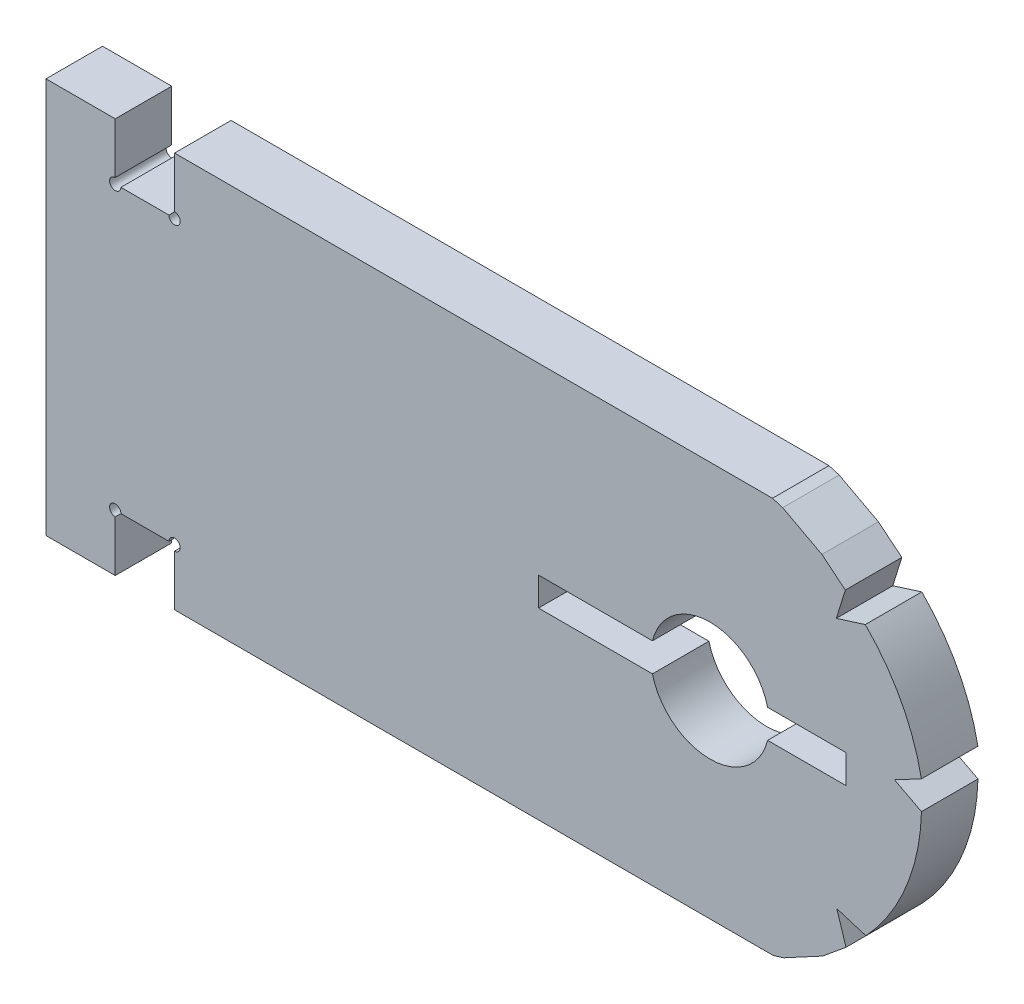
from build123d import *

# Parameters (mm, degrees)
EXTRUDE_1_DEPTH = 2


with BuildPart() as part:
    # 草图1 → 凸台-拉伸1 (new body)
    with BuildSketch(Plane.XY):
        with BuildLine():
            Line((-8.45, -5.2), (-8.45, -7))
            Line((-8.45, -7), (12.741644056, -7))
            Line((12.741644056, -7), (13.101478198, -6.889754544))
            Line((13.101478198, -6.889754544), (14.486104816, -6.144709151))
            Line((14.486104816, -6.144709151), (15.312149212, -5.46294768))
            Line((15.312149212, -5.46294768), (14.987866566, -4.436878246))
            Line((14.987866566, -4.436878246), (16.015719748, -4.755461916))
            ThreePointArc((16.015719748, -4.755461916), (17.441105489, -2.542698595), (17.984281104, 0.032763748))
            Line((17.984281104, 0.032763748), (17.029669504, 0.531416269))
            Line((17.029669504, 0.531416269), (17.981499226, 1.035358552))
            ThreePointArc((17.981499226, 1.035358552), (17.266800727, 3.051396039), (15.995852657, 4.771829734))
            Line((15.995852657, 4.771829734), (14.969602225, 4.448120344))
            Line((14.969602225, 4.448120344), (15.288760048, 5.475795391))
            Line((15.288760048, 5.475795391), (14.459323359, 6.1534255))
            Line((14.459323359, 6.1534255), (13.070995905, 6.891551848))
            Line((13.070995905, 6.891551848), (12.710615967, 7))
            Line((12.710615967, 7), (-8.45, 7))
            Line((-8.45, 7), (-8.45, 5.2))
            ThreePointArc((-8.45, 5.2), (-8.308578644, 4.858578644), (-8.65, 5))
            Line((-8.65, 5), (-10.35, 5))
            ThreePointArc((-10.35, 5), (-10.691421356, 4.858578644), (-10.55, 5.2))
            Line((-10.55, 5.2), (-10.55, 7))
            Line((-10.55, 7), (-13, 7))
            Line((-13, 7), (-13, -7))
            Line((-13, -7), (-10.55, -7))
            Line((-10.55, -7), (-10.55, -5.2))
            ThreePointArc((-10.55, -5.2), (-10.691421356, -4.858578644), (-10.35, -5))
            Line((-10.35, -5), (-8.65, -5))
            ThreePointArc((-8.65, -5), (-8.308578644, -4.858578644), (-8.45, -5.2))
        make_face()
        with BuildLine():
            Line((8.461894687, 0.50608965), (4.430504753, 0.50608965))
            Line((4.430504753, 0.50608965), (4.430504753, -0.50608965))
            Line((4.430504753, -0.50608965), (8.461894687, -0.50608965))
            ThreePointArc((8.461894687, -0.50608965), (10.5, -2.1), (12.538105313, -0.50608965))
            Line((12.538105313, -0.50608965), (15.313201547, -0.50608965))
            Line((15.313201547, -0.50608965), (15.313201547, 0.50608965))
            Line((15.313201547, 0.50608965), (12.538105313, 0.50608965))
            ThreePointArc((12.538105313, 0.50608965), (10.5, 2.1), (8.461894687, 0.50608965))
        make_face(mode=Mode.SUBTRACT)
    extrude(amount=EXTRUDE_1_DEPTH)


solid = part.part
